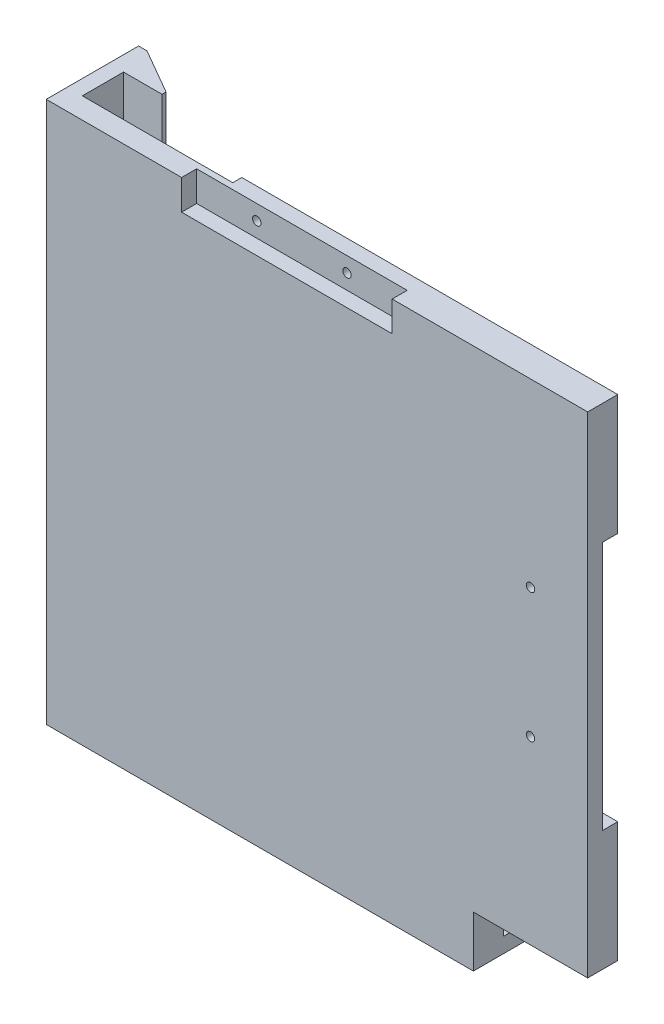
from build123d import *

# Parameters (mm, degrees)
CROQUIS1_W              = 180
CROQUIS1_H              = 180
SALIENTE_EXTRUIR1_DEPTH = 30.7
CROQUIS2_W              = 162.21
CROQUIS2_H              = 162.99
CORTAR_EXTRUIR1_DEPTH   = 20.7
CROQUIS4_W              = 175
CROQUIS4_H              = 10.7
CORTAR_EXTRUIR2_DEPTH   = 175
CORTAR_EXTRUIR3_REACH   = 258.403
CROQUIS5_W              = 38
CROQUIS5_H              = 30.7
CROQUIS6_W              = 38
CROQUIS6_H              = 82.99
CORTAR_EXTRUIR4_DEPTH   = 5
CROQUIS7_W              = 50
CROQUIS7_H              = 175
CORTAR_EXTRUIR5_DEPTH   = 3
CROQUIS8_W              = 70
CROQUIS8_H              = 10
CORTAR_EXTRUIR6_DEPTH   = 5
CHAFL_N1_SIZE           = 15
CHAFL_N1_SIZE2          = 8.660254038
CROQUIS9_R              = 1.4
CORTAR_EXTRUIR7_DEPTH   = 20


with BuildPart() as part:
    # Croquis1 → Saliente-Extruir1 (new body)
    with BuildSketch(Plane.XY):
        with Locations((90, 90)):
            Rectangle(CROQUIS1_W, CROQUIS1_H)
    extrude(amount=SALIENTE_EXTRUIR1_DEPTH)

    # Croquis2 → Cortar-Extruir1 (cut)
    with BuildSketch(Plane(origin=(0, 0, 0), x_dir=(-1, 0, 0), z_dir=(0, 0, -1))):
        with Locations((-98.895, 98.505)):
            Rectangle(CROQUIS2_W, CROQUIS2_H)
    extrude(amount=-CORTAR_EXTRUIR1_DEPTH, mode=Mode.SUBTRACT)

    # Croquis4 → Cortar-Extruir2 (cut)
    with BuildSketch(Plane(origin=(0, 180, 0), x_dir=(1, 0, 0), z_dir=(0, 1, 0))):
        with Locations((92.5, -15.35)):
            Rectangle(CROQUIS4_W, CROQUIS4_H)
    extrude(amount=-CORTAR_EXTRUIR2_DEPTH, mode=Mode.SUBTRACT)

    # Cortar-Extruir3: up to this face of the body (flat: up to its plane)
    cortar_extruir3_end = Plane(part.part.faces().sort_by_distance((98.895, 17.01, 5))[0])
    # Croquis5 → Cortar-Extruir3 (cut, up to the picked face)
    with BuildSketch(Plane.XZ, mode=Mode.PRIVATE) as cortar_extruir3_sk1:
        with Locations((161, 15.35)):
            Rectangle(CROQUIS5_W, CROQUIS5_H)
    cortar_extruir3_tool1 = split(extrude(cortar_extruir3_sk1.sketch, amount=-CORTAR_EXTRUIR3_REACH, mode=Mode.PRIVATE), bisect_by=cortar_extruir3_end, keep=Keep.BOTH, mode=Mode.PRIVATE)
    add(cortar_extruir3_tool1.solids().sort_by(Axis((161, 0, 15.35), (0, 1, 0)))[0], mode=Mode.SUBTRACT)

    # Croquis6 → Cortar-Extruir4 (cut)
    with BuildSketch(Plane(origin=(0, 0, 20.7), x_dir=(-1, 0, 0), z_dir=(0, 0, -1))):
        with Locations((-161, 98.505)):
            Rectangle(CROQUIS6_W, CROQUIS6_H)
    extrude(amount=-CORTAR_EXTRUIR4_DEPTH, mode=Mode.SUBTRACT)

    # Croquis7 → Cortar-Extruir5 (cut)
    with BuildSketch(Plane(origin=(0, 0, 20.7), x_dir=(-1, 0, 0), z_dir=(0, 0, -1))):
        with Locations((-30, 92.5)):
            Rectangle(CROQUIS7_W, CROQUIS7_H)
    extrude(amount=-CORTAR_EXTRUIR5_DEPTH, mode=Mode.SUBTRACT)

    # Croquis8 → Cortar-Extruir6 (cut)
    with BuildSketch(Plane.XY.offset(30.7)):
        with Locations((80, 175)):
            Rectangle(CROQUIS8_W, CROQUIS8_H)
    extrude(amount=-CORTAR_EXTRUIR6_DEPTH, mode=Mode.SUBTRACT)

    # Chaflán1
    chafl_n1_edges = [part.edges().sort_by_distance(p)[0] for p in [
        (17.79, 98.505, 0),
        (79.895, 17.01, 0),
    ]]
    chafl_n1_side = [part.faces().sort_by_distance(p)[0] for p in [
        (8.895, 177.707315983, 0),
    ]]
    chamfer(chafl_n1_edges, length=CHAFL_N1_SIZE, length2=CHAFL_N1_SIZE2, reference=chafl_n1_side[0])

    # Croquis9 → Cortar-Extruir7 (cut)
    with BuildSketch(Plane(origin=(0, 0, 20.7), x_dir=(-1, 0, 0), z_dir=(0, 0, -1))):
        with Locations((-161, 77.01)):
            Circle(CROQUIS9_R)
        with Locations((-161, 120)):
            Circle(CROQUIS9_R)
        with Locations((-65, 175)):
            Circle(CROQUIS9_R)
        with Locations((-95, 175)):
            Circle(CROQUIS9_R)
    extrude(amount=-CORTAR_EXTRUIR7_DEPTH, mode=Mode.SUBTRACT)


solid = part.part
